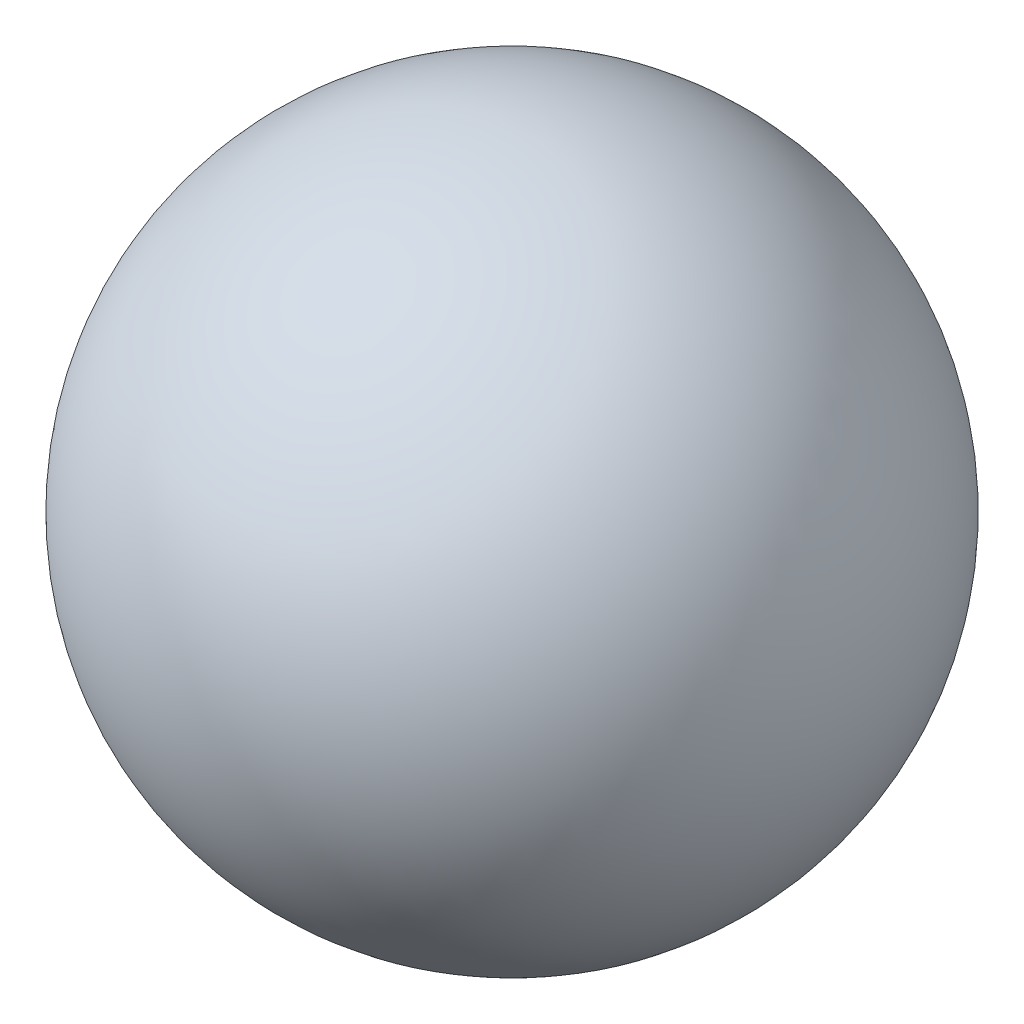
from build123d import *

# Parameters (mm, degrees)
SCALE1_SCALE = 0.266666667


with BuildPart() as part:
    # Sketch1 → Revolve1 (revolve)
    with BuildSketch(Plane(origin=(0, 0, 0), x_dir=(0, 0, -1), z_dir=(1, 0, 0))):
        with BuildLine():
            Line((0, -5), (0, 5))
            ThreePointArc((0, 5), (5, 0), (0, -5))
        make_face()
    revolve(axis=Axis((0, -5, 0), (0, 1, 0)))


with BuildPart() as part_1:
    # Scale1: scaled about (0, 0, 0)
    add(part.part.scale(SCALE1_SCALE))


solid = part_1.part
